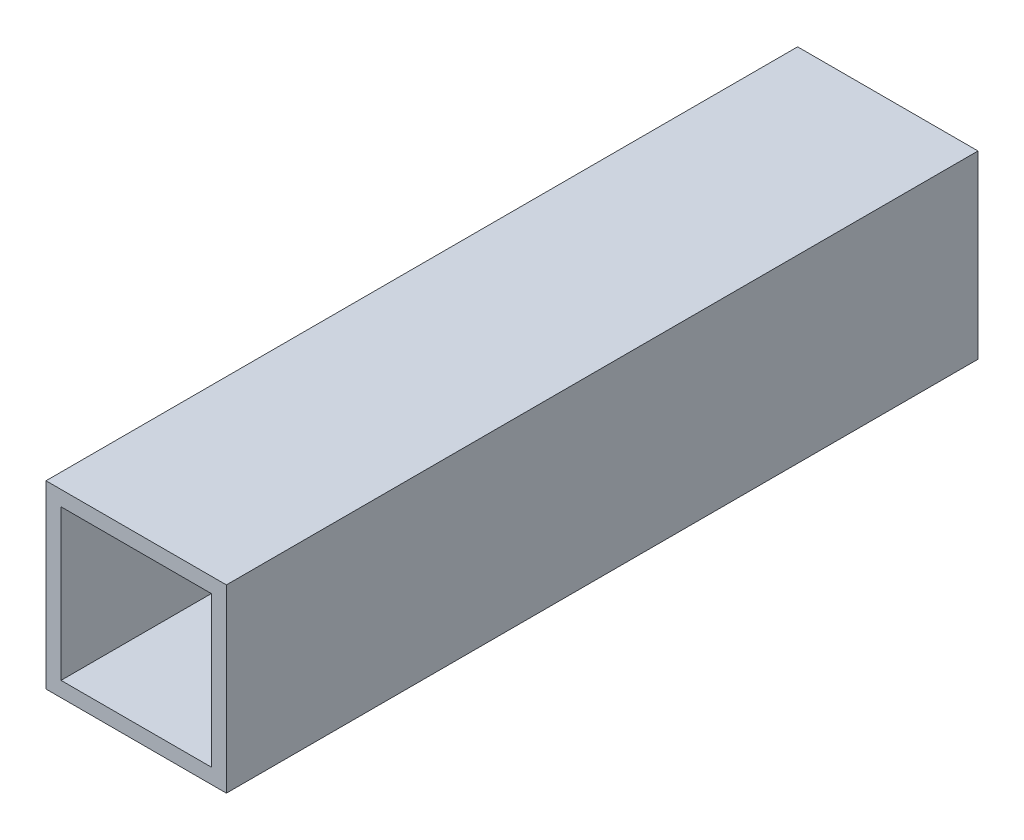
from build123d import *

# Parameters (mm, degrees)
SKETCH_1_W      = 24
SKETCH_1_H      = 24
SKETCH_1_W_2    = 20
SKETCH_1_H_2    = 20
EXTRUDE_1_DEPTH = 100


with BuildPart() as part:
    # 草图1 → 凸台-拉伸1 (new body)
    with BuildSketch(Plane.XY):
        Rectangle(SKETCH_1_W, SKETCH_1_H)
        Rectangle(SKETCH_1_W_2, SKETCH_1_H_2, mode=Mode.SUBTRACT)
    extrude(amount=EXTRUDE_1_DEPTH)


solid = part.part
